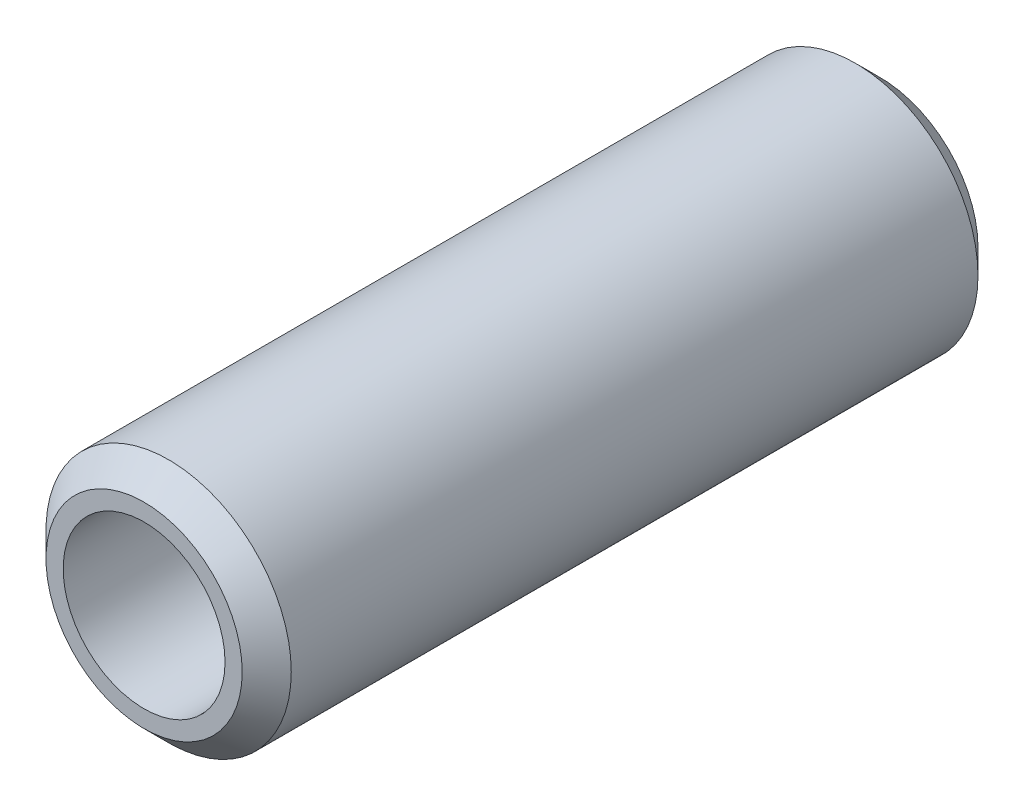
from build123d import *

# Parameters (mm, degrees)
ESQUISSE1_R       = 2.5
EXTRUSION1_DEPTH  = 15
CHANFREIN1_SIZE   = 0.5
TROU_TARAUD_M41_D = 3.3


with BuildPart() as part:
    # Esquisse1 → Extrusion1 (new body)
    with BuildSketch(Plane.XY):
        Circle(ESQUISSE1_R)
    extrude(amount=EXTRUSION1_DEPTH)

    # Chanfrein1
    chanfrein1_edges = [part.edges().sort_by_distance(p)[0] for p in [
        (-2.5, 0, 0),
        (-2.5, 0, 15),
    ]]
    chamfer(chanfrein1_edges, length=CHANFREIN1_SIZE)

    # Trou taraudé M41 (through all)
    with Locations(Plane.XY.offset(15)):
        with Locations((0, 0)):
            Hole(TROU_TARAUD_M41_D / 2)


solid = part.part
